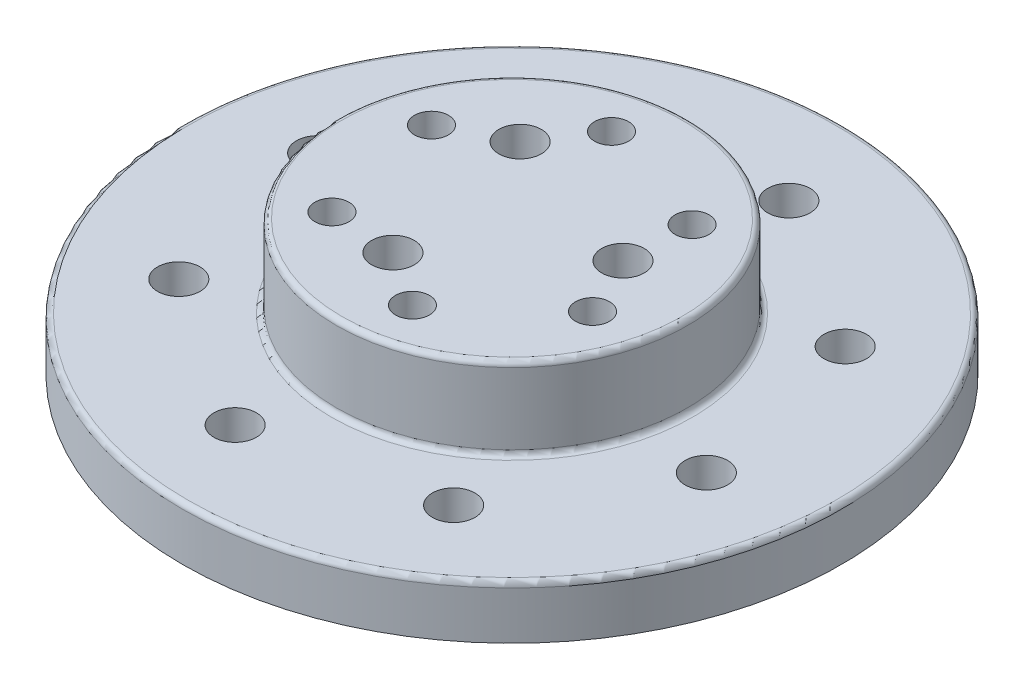
from build123d import *

# Parameters (mm, degrees)
SKETCH1_R           = 31
SKETCH1_R_2         = 13
BOSS_EXTRUDE1_DEPTH = 6.35
SKETCH3_R           = 2
CUT_EXTRUDE1_DEPTH  = 45.29810944
SKETCH2_R           = 16.5
BOSS_EXTRUDE2_DEPTH = 6.35
SKETCH4_R           = 1.6
CUT_EXTRUDE2_DEPTH  = 46.643071763
SKETCH5_R           = 2
CUT_EXTRUDE3_DEPTH  = 46.643071763
CUT_EXTRUDE4_START  = -1.35
SKETCH7_R           = 31
SKETCH7_R_2         = 16.5
CUT_EXTRUDE4_DEPTH  = 1.35
FILLET1_R           = 0.5


with BuildPart() as part:
    # Sketch1 → Boss-Extrude1 (new body)
    with BuildSketch(Plane(origin=(0, 0, 0), x_dir=(1, 0, 0), z_dir=(0, 1, 0))):
        Circle(SKETCH1_R)
        Circle(SKETCH1_R_2, mode=Mode.SUBTRACT)
    extrude(amount=BOSS_EXTRUDE1_DEPTH)

    # Sketch3 → Cut-Extrude1 (cut, through all)
    with BuildSketch(Plane.XZ):
        with Locations((-3.881517499, 22.162667301)):
            Circle(SKETCH3_R)
        with Locations((-12.926724993, -18.416019683)):
            Circle(SKETCH3_R)
        with Locations((3.881517499, -22.162667301)):
            Circle(SKETCH3_R)
        with Locations((18.416019683, -12.926724993)):
            Circle(SKETCH3_R)
        with Locations((22.162667301, 3.881517499)):
            Circle(SKETCH3_R)
        with Locations((12.926724993, 18.416019683)):
            Circle(SKETCH3_R)
        with Locations((-18.416019683, 12.926724993)):
            Circle(SKETCH3_R)
        with Locations((-22.162667301, -3.881517499)):
            Circle(SKETCH3_R)
    extrude(amount=-CUT_EXTRUDE1_DEPTH, mode=Mode.SUBTRACT)

    # Sketch2 → Boss-Extrude2 (add)
    with BuildSketch(Plane(origin=(0, 6.35, 0), x_dir=(1, 0, 0), z_dir=(0, 1, 0))):
        Circle(SKETCH2_R)
    extrude(amount=BOSS_EXTRUDE2_DEPTH)

    # Sketch4 → Cut-Extrude2 (cut, through all)
    with BuildSketch(Plane(origin=(0, 12.7, 0), x_dir=(1, 0, 0), z_dir=(0, 1, 0))):
        with Locations((-8.985259132, -7.953937285)):
            Circle(SKETCH4_R)
        with Locations((-11.380941315, 3.804494025)):
            Circle(SKETCH4_R)
        with Locations((-2.395682183, 11.75843131)):
            Circle(SKETCH4_R)
        with Locations((8.985259131, 7.953937285)):
            Circle(SKETCH4_R)
        with Locations((11.380941314, -3.804494026)):
            Circle(SKETCH4_R)
        with Locations((2.395682183, -11.75843131)):
            Circle(SKETCH4_R)
    extrude(amount=-CUT_EXTRUDE2_DEPTH, mode=Mode.SUBTRACT)

    # Sketch5 → Cut-Extrude3 (cut, through all)
    with BuildSketch(Plane(origin=(0, 12.7, 0), x_dir=(1, 0, 0), z_dir=(0, 1, 0))):
        with Locations((-2.805814344, -8.393444219)):
            Circle(SKETCH5_R)
        with Locations((-5.866028748, 6.626628609)):
            Circle(SKETCH5_R)
        with Locations((8.671843091, 1.76681561)):
            Circle(SKETCH5_R)
    extrude(amount=-CUT_EXTRUDE3_DEPTH, mode=Mode.SUBTRACT)

    # Sketch7 → Cut-Extrude4 (cut)
    with BuildSketch(Plane(origin=(0, 6.35, 0), x_dir=(1, 0, 0), z_dir=(0, 1, 0)).offset(CUT_EXTRUDE4_START)):
        Circle(SKETCH7_R)
        Circle(SKETCH7_R_2, mode=Mode.SUBTRACT)
    extrude(amount=CUT_EXTRUDE4_DEPTH, mode=Mode.SUBTRACT)

    # Fillet1
    fillet1_edges = [part.edges().sort_by_distance(p)[0] for p in [
        (-16.5, 5, 0),
        (-16.5, 12.7, 0),
        (-31, 5, 0),
    ]]
    fillet(fillet1_edges, radius=FILLET1_R)


solid = part.part
